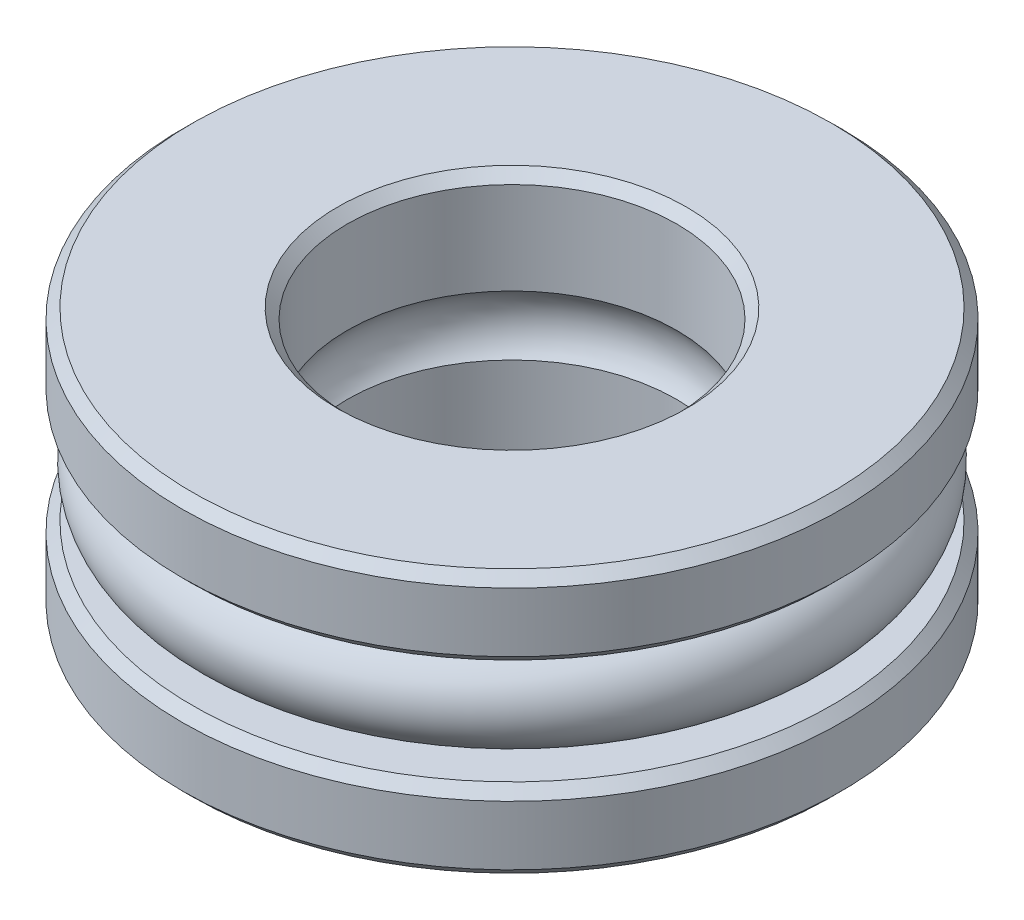
from build123d import *


with BuildPart() as part:
    # Sketch1 → Revolve1 (revolve)
    with BuildSketch(Plane.XY, mode=Mode.PRIVATE) as revolve1_sk:
        with BuildLine():
            Line((5, 0.95), (5, 1.851651123))
            Line((5, 1.851651123), (4.85, 2))
            Line((4.85, 2), (2.648348877, 2))
            Line((2.648348877, 2), (2.5, 1.851651123))
            Line((2.5, 1.851651123), (2.5, 0.453458929))
            ThreePointArc((2.5, 0.453458929), (2.675, 0), (2.5, -0.453458929))
            Line((2.5, -0.453458929), (2.5, -1.85))
            Line((2.5, -1.85), (2.648348877, -2))
            Line((2.648348877, -2), (4.85, -2))
            Line((4.85, -2), (5, -1.85))
            Line((5, -1.85), (5, -0.95))
            Line((5, -0.95), (4.85, -0.8))
            Line((4.85, -0.8), (4.2, -0.8))
            Line((4.2, -0.8), (4.2, -0.675))
            ThreePointArc((4.2, -0.675), (4.875, 0), (4.2, 0.675))
            Line((4.2, 0.675), (4.2, 0.8))
            Line((4.2, 0.8), (4.85, 0.8))
            Line((4.85, 0.8), (5, 0.95))
        make_face()
    revolve(revolve1_sk.sketch.rotate(Axis((0, -7.575237451, 0), (0, 1, 0)), 90), axis=Axis((0, -7.575237451, 0), (0, 1, 0)))


solid = part.part
